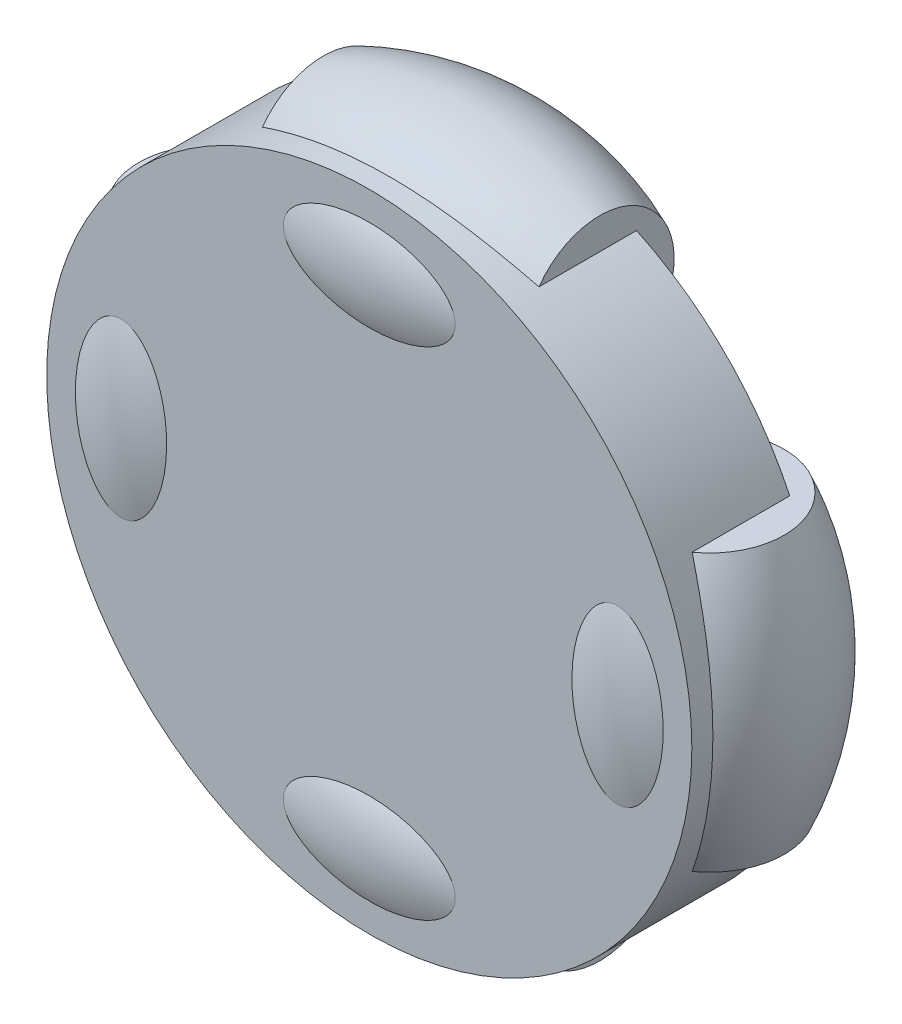
from build123d import *

# Parameters (mm, degrees)
EXTRUDE_1_DEPTH          = 5
EXTRUDE_1_DEPTH_BACK     = 2
SKETCH_2_R               = 17.5
PATTERN_CIRCULAR_1_COUNT = 4


with BuildPart() as part:
    # ｽｹｯﾁ1 → 回転1 (revolve)
    with BuildSketch(Plane.XY, mode=Mode.PRIVATE) as revolve_1_sk:
        with BuildLine():
            Line((-7.5, 17.511496224), (-7.5, 13.470384182))
            Line((-7.5, 13.470384182), (7.5, 13.470384182))
            Line((7.5, 13.470384182), (7.5, 17.511496224))
            ThreePointArc((7.5, 17.511496224), (0, 19.05), (-7.5, 17.511496224))
        make_face()
    revolve_1 = revolve(revolve_1_sk.sketch.rotate(Axis((-13.470384182, 13.470384182, 0), (1, 0, 0)), 90), axis=Axis((-13.470384182, 13.470384182, 0), (1, 0, 0)))

    # ｽｹｯﾁ2 → ﾎﾞｽ - 押し出し1 (add, two sides: drawn at the far end of the back side and taken through both)
    with BuildSketch(Plane.XY.offset(-EXTRUDE_1_DEPTH_BACK)):
        Circle(SKETCH_2_R)
    extrude(amount=EXTRUDE_1_DEPTH + EXTRUDE_1_DEPTH_BACK)

    # 円形ﾊﾟﾀｰﾝ1: 回転1 ×4 about axis
    pattern_circular_1_axis = Axis((0, 0, 0), (0, 0, 1))
    for i in range(1, PATTERN_CIRCULAR_1_COUNT):
        add(revolve_1.rotate(pattern_circular_1_axis, i * 360 / PATTERN_CIRCULAR_1_COUNT))


solid = part.part
